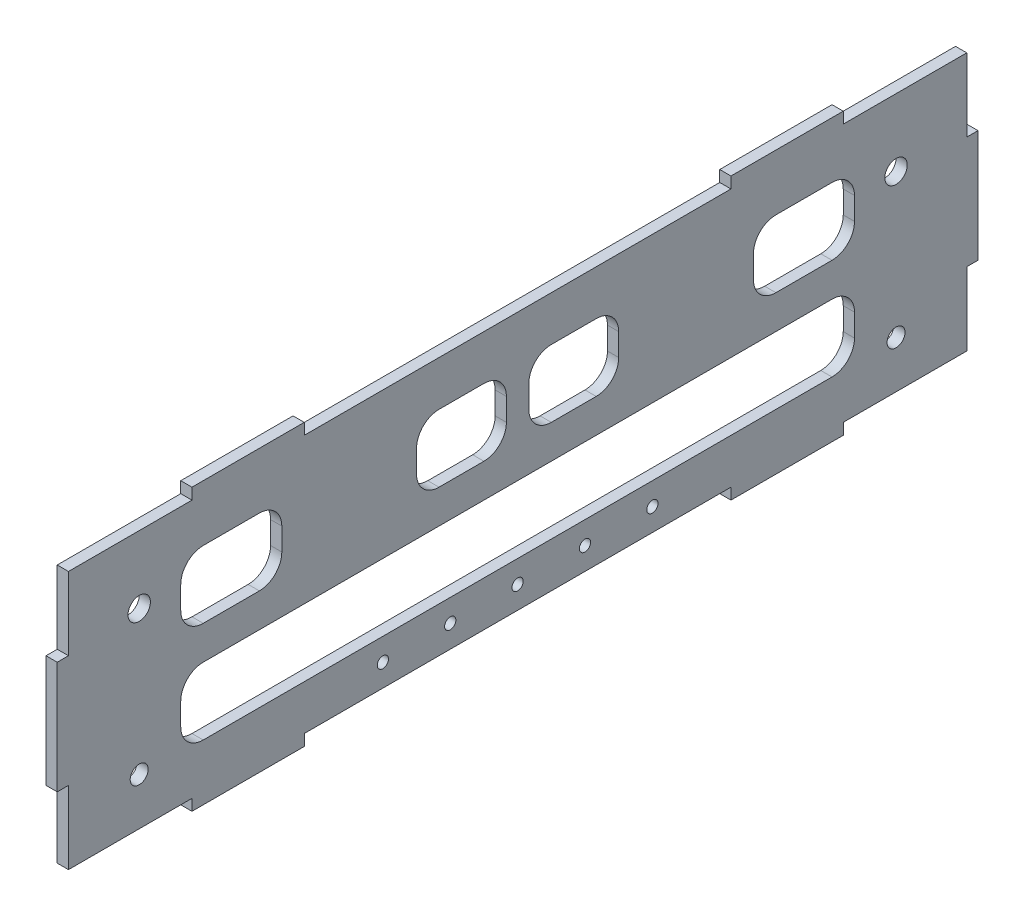
from build123d import *

# Parameters (mm, degrees)
SKETCH_1_R      = 5
SKETCH_1_R_2    = 4
SKETCH_1_R_3    = 2.5
EXTRUDE_1_DEPTH = 5


with BuildPart() as part:
    # 草图1 → 凸台-拉伸1 (new body)
    with BuildSketch(Plane(origin=(0, 0, 0), x_dir=(0, 0, -1), z_dir=(1, 0, 0))):
        Polygon((-400, 82.5), (-400, 115), (-345, 115), (-345, 120), (-295, 120), (-295, 115), (-105, 115), (-105, 120), (-55, 120), (-55, 115), (0, 115), (0, 82.5), (5, 82.5), (5, 32.5), (0, 32.5), (0, 0), (-55, 0), (-55, -5), (-105, -5), (-105, 0), (-295, 0), (-295, -5), (-345, -5), (-345, 0), (-400, 0), (-400, 32.5), (-405, 32.5), (-405, 82.5), align=None)
        with Locations((-368.5, 85)):
            Circle(SKETCH_1_R, mode=Mode.SUBTRACT)
        with Locations((-368.5, 21)):
            Circle(SKETCH_1_R_2, mode=Mode.SUBTRACT)
        with Locations((-31.5, 21)):
            Circle(SKETCH_1_R_2, mode=Mode.SUBTRACT)
        with Locations((-31.5, 85)):
            Circle(SKETCH_1_R, mode=Mode.SUBTRACT)
        with Locations((-200, 10)):
            Circle(SKETCH_1_R_3, mode=Mode.SUBTRACT)
        with Locations((-170, 10)):
            Circle(SKETCH_1_R_3, mode=Mode.SUBTRACT)
        with Locations((-140, 10)):
            Circle(SKETCH_1_R_3, mode=Mode.SUBTRACT)
        with Locations((-230, 10)):
            Circle(SKETCH_1_R_3, mode=Mode.SUBTRACT)
        with Locations((-260, 10)):
            Circle(SKETCH_1_R_3, mode=Mode.SUBTRACT)
        with BuildLine():
            Line((-340, 50), (-60, 50))
            ThreePointArc((-60, 50), (-52.928932188, 47.071067812), (-50, 40))
            Line((-50, 40), (-50, 30))
            ThreePointArc((-50, 30), (-52.928932188, 22.928932188), (-60, 20))
            Line((-60, 20), (-340, 20))
            ThreePointArc((-340, 20), (-347.071067812, 22.928932188), (-350, 30))
            Line((-350, 30), (-350, 40))
            ThreePointArc((-350, 40), (-347.071067812, 47.071067812), (-340, 50))
        make_face(mode=Mode.SUBTRACT)
        with BuildLine():
            Line((-340, 95), (-315, 95))
            ThreePointArc((-315, 95), (-307.928932188, 92.071067812), (-305, 85))
            Line((-305, 85), (-305, 75))
            ThreePointArc((-305, 75), (-307.928932188, 67.928932188), (-315, 65))
            Line((-315, 65), (-340, 65))
            ThreePointArc((-340, 65), (-347.071067812, 67.928932188), (-350, 75))
            Line((-350, 75), (-350, 85))
            ThreePointArc((-350, 85), (-347.071067812, 92.071067812), (-340, 95))
        make_face(mode=Mode.SUBTRACT)
        with BuildLine():
            Line((-50, 85), (-50, 75))
            ThreePointArc((-50, 75), (-52.928932188, 67.928932188), (-60, 65))
            Line((-60, 65), (-85, 65))
            ThreePointArc((-85, 65), (-92.071067812, 67.928932188), (-95, 75))
            Line((-95, 75), (-95, 85))
            ThreePointArc((-95, 85), (-92.071067812, 92.071067812), (-85, 95))
            Line((-85, 95), (-60, 95))
            ThreePointArc((-60, 95), (-52.928932188, 92.071067812), (-50, 85))
        make_face(mode=Mode.SUBTRACT)
        with BuildLine():
            Line((-185, 65), (-165, 65))
            ThreePointArc((-165, 65), (-157.928932188, 67.928932188), (-155, 75))
            Line((-155, 75), (-155, 85))
            ThreePointArc((-155, 85), (-157.928932188, 92.071067812), (-165, 95))
            Line((-165, 95), (-185, 95))
            ThreePointArc((-185, 95), (-192.071067812, 92.071067812), (-195, 85))
            Line((-195, 85), (-195, 75))
            ThreePointArc((-195, 75), (-192.071067812, 67.928932188), (-185, 65))
        make_face(mode=Mode.SUBTRACT)
        with BuildLine():
            Line((-235, 65), (-215, 65))
            ThreePointArc((-215, 65), (-207.928932188, 67.928932188), (-205, 75))
            Line((-205, 75), (-205, 85))
            ThreePointArc((-205, 85), (-207.928932188, 92.071067812), (-215, 95))
            Line((-215, 95), (-235, 95))
            ThreePointArc((-235, 95), (-242.071067812, 92.071067812), (-245, 85))
            Line((-245, 85), (-245, 75))
            ThreePointArc((-245, 75), (-242.071067812, 67.928932188), (-235, 65))
        make_face(mode=Mode.SUBTRACT)
    extrude(amount=EXTRUDE_1_DEPTH)


solid = part.part
